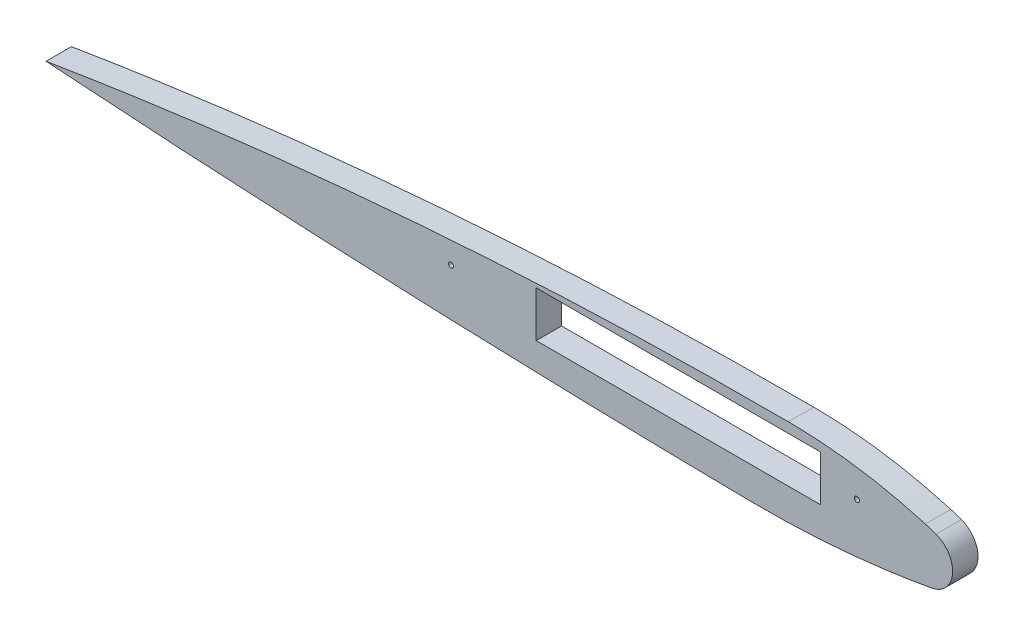
from build123d import *

# Parameters (mm, degrees)
BOSS_EXTRUDE1_DEPTH = 6.35
FILLET1_R           = 6.35
SKETCH2_W           = 71.12
SKETCH2_H           = 11.43
CUT_EXTRUDE1_DEPTH  = 207.956858886
SKETCH3_R           = 0.635
CUT_EXTRUDE2_DEPTH  = 207.956858886
SKETCH6_OUTSIDE_W   = 361.165
SKETCH6_OUTSIDE_H   = 90.651
CUT_EXTRUDE4_DEPTH  = 207.956858886
FILLET3_R           = 6.35


with BuildPart() as part:
    # Sketch1 → Boss-Extrude1 (new body)
    with BuildSketch(Plane.XY):
        with BuildLine():
            add(Edge.make_bspline(
                [(36.979706214, 32.461234237), (-84.593483907, 33.006022806), (-204.294256369, 13.29140622)],
                knots=[1.565963281, 1.565963281, 1.565963281, 1.746596348, 1.746596348, 1.746596348], degree=2, weights=[1, 0.995924234, 1]))
            add(Edge.make_bspline(
                [(-204.294256369, 13.29140622), (-90.184781375, 5.397938815), (24.279187945, 3.948004614)],
                knots=[4.63926443, 4.63926443, 4.63926443, 4.706613661, 4.706613661, 4.706613661], degree=2, weights=[1, 0.999433064, 1]))
            add(Edge.make_bspline(
                [(24.279187945, 3.948004614), (64.56807699, 3.437658533), (103.433890649, 13.29140622)],
                knots=[4.698727851, 4.698727851, 4.698727851, 4.979307673, 4.979307673, 4.979307673], degree=2, weights=[1, 0.9901755, 1]))
            add(Edge.make_bspline(
                [(103.433890649, 13.29140622), (94.233757809, 22.223302177), (81.53716289, 25.9598127)],
                knots=[0.762399197, 0.762399197, 0.762399197, 1.263449558, 1.263449558, 1.263449558], degree=2, weights=[1, 0.968782356, 1]))
            add(Edge.make_bspline(
                [(81.53716289, 25.9598127), (59.792823381, 32.359005074), (36.979706214, 32.461234237)],
                knots=[1.263449558, 1.263449558, 1.263449558, 1.565963281, 1.565963281, 1.565963281], degree=2, weights=[1, 0.988582474, 1]))
        make_face()
    extrude(amount=BOSS_EXTRUDE1_DEPTH)

    # Fillet1
    fillet1_edges = [part.edges().sort_by_distance(p)[0] for p in [
        (103.433890649, 13.29140622, 3.175),
    ]]
    fillet(fillet1_edges, radius=FILLET1_R)

    # Sketch2 → Cut-Extrude1 (cut, through all)
    with BuildSketch(Plane(origin=(0, 0, 0), x_dir=(-1, 0, 0), z_dir=(0, 0, -1))):
        with Locations((46.047690277, 19.812)):
            Rectangle(SKETCH2_W, SKETCH2_H)
    extrude(amount=-CUT_EXTRUDE1_DEPTH, mode=Mode.SUBTRACT)

    # Sketch3 → Cut-Extrude2 (cut, through all)
    with BuildSketch(Plane.XY):
        with Locations((-1.343690277, 19.812)):
            Circle(SKETCH3_R)
        with Locations((-102.943690277, 19.812)):
            Circle(SKETCH3_R)
    extrude(amount=CUT_EXTRUDE2_DEPTH, mode=Mode.SUBTRACT)

    # Sketch6 outside → Cut-Extrude4 (cut, through all)
    with BuildSketch(Plane.XY):
        with Locations((-54.7605, 18.1995)):
            Rectangle(SKETCH6_OUTSIDE_W, SKETCH6_OUTSIDE_H)
        with BuildLine():
            add(Edge.make_bspline(
                [(-18.51330518, 28.052173793), (-112.124661574, 28.471660991), (-204.294256369, 13.29140622)],
                knots=[1.565963281, 1.565963281, 1.565963281, 1.746596348, 1.746596348, 1.746596348], degree=2, weights=[1, 0.995924234, 1]))
            add(Edge.make_bspline(
                [(-204.294256369, 13.29140622), (-116.429960623, 7.213436318), (-28.292704248, 6.096986983)],
                knots=[1.497671776, 1.497671776, 1.497671776, 1.565021007, 1.565021007, 1.565021007], degree=2, weights=[1, 0.999433064, 1]))
            add(Edge.make_bspline(
                [(-28.292704248, 6.096986983), (2.729740317, 5.704020501), (32.656416835, 13.29140622)],
                knots=[4.698727851, 4.698727851, 4.698727851, 4.979307673, 4.979307673, 4.979307673], degree=2, weights=[1, 0.9901755, 1]))
            add(Edge.make_bspline(
                [(32.656416835, 13.29140622), (25.572314548, 20.168966107), (15.79593646, 23.046079209)],
                knots=[0.762399197, 0.762399197, 0.762399197, 1.263449558, 1.263449558, 1.263449558], degree=2, weights=[1, 0.968782356, 1]))
            add(Edge.make_bspline(
                [(15.79593646, 23.046079209), (-0.947204961, 27.973457337), (-18.51330518, 28.052173793)],
                knots=[1.263449558, 1.263449558, 1.263449558, 1.565963281, 1.565963281, 1.565963281], degree=2, weights=[1, 0.988582474, 1]))
        make_face(mode=Mode.SUBTRACT)
    extrude(amount=CUT_EXTRUDE4_DEPTH, mode=Mode.SUBTRACT)

    # Fillet3
    fillet3_edges = [part.edges().sort_by_distance(p)[0] for p in [
        (32.656416835, 13.29140622, 3.175),
    ]]
    fillet(fillet3_edges, radius=FILLET3_R)


solid = part.part
